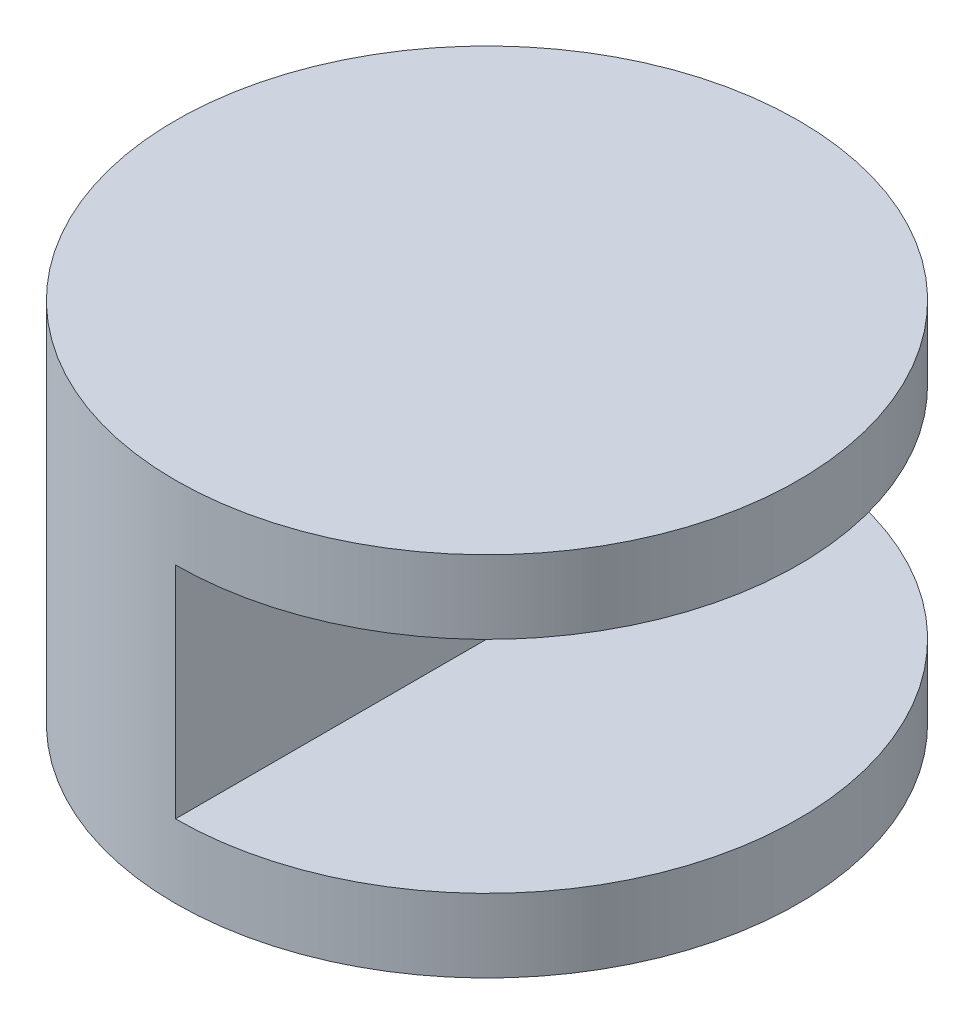
from build123d import *

# Parameters (mm, degrees)
SKETCH2_R           = 10.795
BOSS_EXTRUDE1_DEPTH = 12.7
SKETCH3_W           = 25.439299018
SKETCH3_H           = 7.62
CUT_EXTRUDE1_DEPTH  = 20.858349629


with BuildPart() as part:
    # Sketch2 → Boss-Extrude1 (new body)
    with BuildSketch(Plane(origin=(0, 0, 0), x_dir=(1, 0, 0), z_dir=(0, 1, 0))):
        with Locations(Location((0, 0, 0), (0, 0, 270))):
            Circle(SKETCH2_R)
    extrude(amount=-BOSS_EXTRUDE1_DEPTH)

    # Sketch3 → Cut-Extrude1 (cut, through all)
    with BuildSketch(Plane(origin=(0, 0, 0), x_dir=(0, 0, -1), z_dir=(1, 0, 0))):
        with Locations((-0.92844157, -6.35)):
            Rectangle(SKETCH3_W, SKETCH3_H)
    extrude(amount=CUT_EXTRUDE1_DEPTH, mode=Mode.SUBTRACT)


solid = part.part
